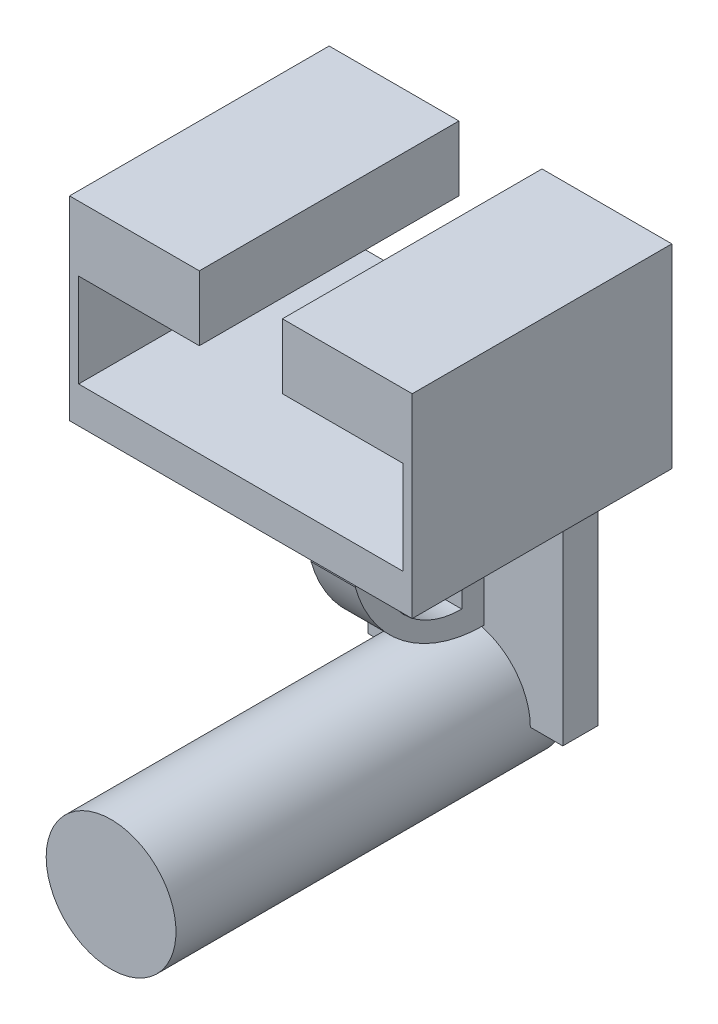
from build123d import *

# Parameters (mm, degrees)
BOSS_EXTRUDE4_DEPTH  = 6.858
SKETCH7_R            = 12.7
BOSS_EXTRUDE5_DEPTH  = 76.2
SKETCH9_W            = 63.5
SKETCH9_H            = 50.8
BOSS_EXTRUDE6_DEPTH  = 7.112
SKETCH11_W           = 50.8
SKETCH11_H           = 38.1
BOSS_EXTRUDE7_DEPTH  = 1.778
SKETCH12_W           = 50.8
SKETCH12_H           = 38.1
BOSS_EXTRUDE8_DEPTH  = 1.778
SKETCH14_W           = 25.4
SKETCH14_H           = 50.8
BOSS_EXTRUDE9_DEPTH  = 12.7
SKETCH15_W           = 25.4
SKETCH15_H           = 50.8
BOSS_EXTRUDE10_DEPTH = 12.7
SKETCH19_W           = 8.653186955
SKETCH19_H           = 38.1
BOSS_EXTRUDE11_DEPTH = 32.004
CUT_EXTRUDE4_DEPTH   = 8.653187
CUT_EXTRUDE5_DEPTH   = 8.653187


with BuildPart() as part:
    # Sketch3 → Boss-Extrude4 (new body)
    with BuildSketch(Plane.XY):
        with BuildLine():
            Line((0, 0), (6.35, 0))
            ThreePointArc((6.35, 0), (19.05, 12.7), (31.75, 0))
            Line((31.75, 0), (38.1, 0))
            Line((38.1, 0), (38.1, 50.8))
            Line((38.1, 50.8), (0, 50.8))
            Line((0, 50.8), (0, 0))
        make_face()
    extrude(amount=BOSS_EXTRUDE4_DEPTH)

    # Sketch7 → Boss-Extrude5 (add)
    with BuildSketch(Plane(origin=(0, 0, 0), x_dir=(-1, 0, 0), z_dir=(0, 0, -1))):
        with Locations((-19.05, 0)):
            Circle(SKETCH7_R)
    extrude(amount=-BOSS_EXTRUDE5_DEPTH)

    # Sketch9 → Boss-Extrude6 (add)
    with BuildSketch(Plane(origin=(0, 50.8, 0), x_dir=(1, 0, 0), z_dir=(0, 1, 0))):
        with Locations((19.05, -25.4)):
            Rectangle(SKETCH9_W, SKETCH9_H)
    extrude(amount=BOSS_EXTRUDE6_DEPTH)

    # Sketch11 → Boss-Extrude7 (add)
    with BuildSketch(Plane(origin=(50.8, 0, 0), x_dir=(0, 0, -1), z_dir=(1, 0, 0))):
        with Locations((-25.4, 69.85)):
            Rectangle(SKETCH11_W, SKETCH11_H)
    extrude(amount=BOSS_EXTRUDE7_DEPTH)

    # Sketch12 → Boss-Extrude8 (add)
    with BuildSketch(Plane.ZY.offset(12.7)):
        with Locations((25.4, 69.85)):
            Rectangle(SKETCH12_W, SKETCH12_H)
    extrude(amount=BOSS_EXTRUDE8_DEPTH)

    # Sketch14 → Boss-Extrude9 (add)
    with BuildSketch(Plane(origin=(0, 88.9, 0), x_dir=(1, 0, 0), z_dir=(0, 1, 0))):
        with Locations((39.878, -25.4)):
            Rectangle(SKETCH14_W, SKETCH14_H)
    extrude(amount=-BOSS_EXTRUDE9_DEPTH)

    # Sketch15 → Boss-Extrude10 (add)
    with BuildSketch(Plane(origin=(0, 88.9, 0), x_dir=(1, 0, 0), z_dir=(0, 1, 0))):
        with Locations((-1.778, -25.4)):
            Rectangle(SKETCH15_W, SKETCH15_H)
    extrude(amount=-BOSS_EXTRUDE10_DEPTH)


with BuildPart() as body_2:
    # Sketch19 → Boss-Extrude11 (new body)
    with BuildSketch(Plane.XY):
        with Locations((18.309081845, 31.75)):
            Rectangle(SKETCH19_W, SKETCH19_H)
    extrude(amount=BOSS_EXTRUDE11_DEPTH)

    # Sketch26 → Cut-Extrude4 (cut)
    with BuildSketch(Plane.ZY.offset(-13.982488368)):
        with BuildLine():
            Line((32.004, 31.75), (32.004, 12.7))
            Line((32.004, 12.7), (6.858, 12.7))
            ThreePointArc((6.858, 12.7), (22.631584057, 18.000229045), (32.004, 31.75))
        make_face()
    extrude(amount=-CUT_EXTRUDE4_DEPTH, mode=Mode.SUBTRACT)

    # Sketch28 → Cut-Extrude5 (cut)
    with BuildSketch(Plane.ZY.offset(-13.982488368)):
        with BuildLine():
            Line((11.158058449, 47.185073314), (11.158058449, 17.611593285))
            ThreePointArc((11.158058449, 17.611593285), (22.019922173, 21.878833952), (27.072600667, 32.3983333))
            Line((27.072600667, 32.3983333), (27.072600667, 47.185073314))
            Line((27.072600667, 47.185073314), (11.158058449, 47.185073314))
        make_face()
    extrude(amount=-CUT_EXTRUDE5_DEPTH, mode=Mode.SUBTRACT)


solid = Compound([part.part, body_2.part])
